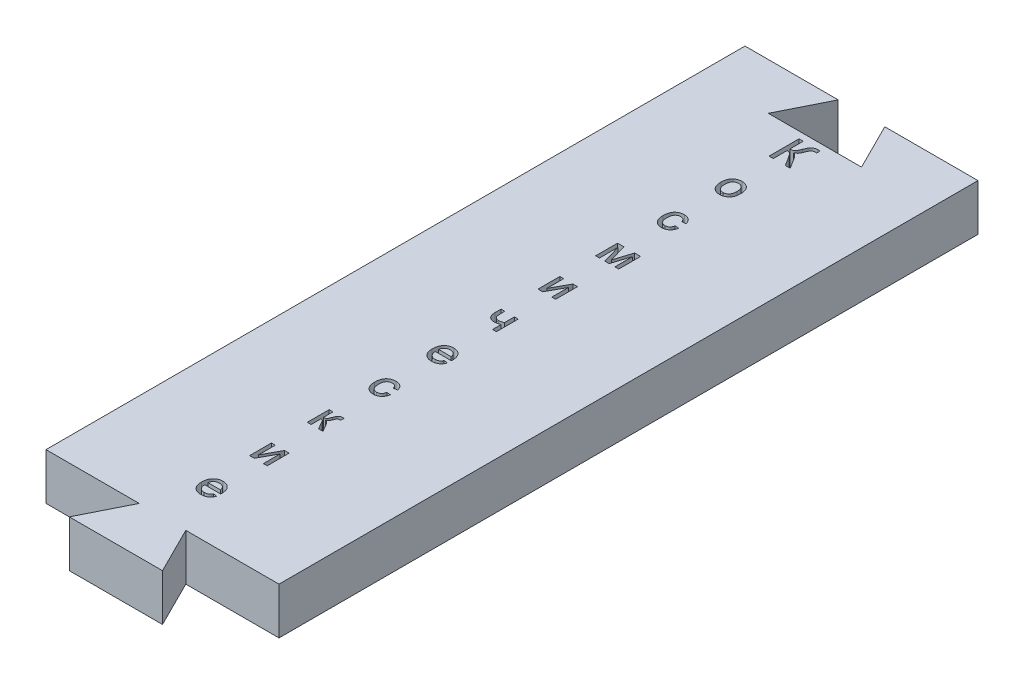
from build123d import *

# Parameters (mm, degrees)
EXTRUDE_1_DEPTH     = 4
CUT_EXTRUDE_1_DEPTH = 44.843471578


with BuildPart() as part:
    # Эскиз1 → Бобышка-Вытянуть1 (new body)
    with BuildSketch(Plane(origin=(0, 0, 0), x_dir=(1, 0, 0), z_dir=(0, 1, 0))):
        Polygon((10, 42.5), (2, 42.5), (4, 38.5), (-4, 38.5), (-2, 42.5), (-10, 42.5), (-10, -17.5), (-2, -17.5), (-4, -21.5), (4, -21.5), (2, -17.5), (10, -17.5), align=None)
    extrude(amount=EXTRUDE_1_DEPTH)

    # Эскиз2 → Вырез-Вытянуть1 (cut, through all)
    # profile 1 of 11: a face of its own
    with BuildSketch(Plane(origin=(0, 0, 0), x_dir=(1, 0, 0), z_dir=(0, 1, 0))):
        with BuildLine():
            Line((-0.784952159, 37.922443321), (-0.42275337, 37.922443321))
            Line((-0.42275337, 37.922443321), (-0.42275337, 36.769992629))
            add(Edge.make_bspline(
                [(-0.42275337, 36.769992629), (-0.403881568, 36.770314623), (-0.367463242, 36.770935998), (-0.314864045, 36.774948473), (-0.266491711, 36.781930258), (-0.222649993, 36.792260042), (-0.183058176, 36.804958938), (-0.148026012, 36.820875697), (-0.117099279, 36.839481866), (-0.08956018, 36.862044499), (-0.064195799, 36.890897859), (-0.038171899, 36.926434747), (-0.01091042, 36.970330579), (0.018184901, 37.021949927), (0.048591973, 37.082096414), (0.080139294, 37.150372427), (0.113733782, 37.226643308), (0.135765877, 37.280480457), (0.147298133, 37.30866043)],
                knots=[0, 0, 0, 0, 1.052200849, 2.030510562, 2.939243925, 3.774201544, 4.539213851, 5.253802474, 5.914681743, 6.546419206, 7.230145694, 8.050577361, 9.000291826, 10.109225702, 11.353633581, 12.756759924, 14.30239122, 16, 16, 16, 16], degree=3))
            add(Edge.make_bspline(
                [(0.147298133, 37.30866043), (0.155583277, 37.329631548), (0.171547327, 37.370039291), (0.196431945, 37.427449705), (0.219739551, 37.480274434), (0.241400604, 37.528610059), (0.26325839, 37.571549896), (0.283081777, 37.61013506), (0.302839692, 37.64328408), (0.326471473, 37.682200209), (0.360433187, 37.725261698), (0.407126331, 37.772485623), (0.462709382, 37.813877052), (0.523699256, 37.852010502), (0.59078251, 37.883307131), (0.662144029, 37.906035839), (0.736891187, 37.919739547), (0.787777454, 37.921534114), (0.81355869, 37.922443321)],
                knots=[0, 0, 0, 0, 1.107067364, 2.133128729, 3.071894941, 3.942310447, 4.733123171, 5.437484158, 6.071489014, 6.62756277, 7.671844125, 8.755510869, 9.878854834, 11.066000059, 12.282817432, 13.502486747, 14.734649208, 16, 16, 16, 16], degree=3))
            add(Edge.make_bspline(
                [(0.81355869, 37.922443321), (0.829336219, 37.922425752), (0.859004835, 37.922392714), (0.900508865, 37.922607217), (0.936008684, 37.921964656), (0.965500704, 37.921437164), (0.98901151, 37.921064346), (1.00664056, 37.920270399), (1.018405136, 37.920416281), (1.024160433, 37.919229772), (1.026041786, 37.918841913)],
                knots=[0, 0, 0, 0, 1.781031572, 3.349113717, 4.685027671, 5.788662687, 6.679388873, 7.337880823, 7.783559366, 8, 8, 8, 8], degree=3))
            Line((1.026041786, 37.918841913), (1.026041786, 37.622497449))
            add(Edge.make_bspline(
                [(1.026041786, 37.622497449), (1.022439824, 37.622467266), (1.013860769, 37.622395377), (0.998778191, 37.62317291), (0.97938632, 37.623437851), (0.964987656, 37.624159888), (0.957100539, 37.624555397)],
                knots=[0, 0, 0, 0, 0.626520386, 1.492229436, 2.626325481, 4, 4, 4, 4], degree=3))
            add(Edge.make_bspline(
                [(0.957100539, 37.624555397), (0.948525784, 37.624727971), (0.93326186, 37.625035172), (0.913022275, 37.625428904), (0.89845338, 37.626176686), (0.890560607, 37.626119853), (0.887644805, 37.626098857)],
                knots=[0, 0, 0, 0, 1.481338244, 2.636930747, 3.496445698, 4, 4, 4, 4], degree=3))
            add(Edge.make_bspline(
                [(0.887644805, 37.626098857), (0.861820437, 37.625229401), (0.813283249, 37.623595249), (0.745947273, 37.608569275), (0.68784555, 37.58460307), (0.657819889, 37.558842196), (0.64326352, 37.546353385)],
                knots=[0, 0, 0, 0, 1.174590339, 2.207655611, 3.131075699, 4, 4, 4, 4], degree=3))
            add(Edge.make_bspline(
                [(0.64326352, 37.546353385), (0.636270961, 37.538922122), (0.621140688, 37.522842594), (0.599753132, 37.494325113), (0.577762319, 37.460098966), (0.554606771, 37.420525898), (0.531025903, 37.375148419), (0.507026384, 37.324020841), (0.481674561, 37.267542214), (0.465463509, 37.227598495), (0.457019257, 37.206792021)],
                knots=[0, 0, 0, 0, 0.628540474, 1.360015561, 2.192637814, 3.135330014, 4.184910091, 5.343283619, 6.616130308, 8, 8, 8, 8], degree=3))
            add(Edge.make_bspline(
                [(0.457019257, 37.206792021), (0.446347071, 37.180497794), (0.42602825, 37.130436103), (0.394911836, 37.059692907), (0.365711658, 36.996254904), (0.337853891, 36.940224553), (0.310285829, 36.892231119), (0.28493428, 36.851318643), (0.260422517, 36.818159617), (0.229276935, 36.78430596), (0.188297737, 36.749980939), (0.135868777, 36.713905848), (0.079493823, 36.681140708), (0.039106599, 36.663613723), (0.018676404, 36.65474756)],
                knots=[0, 0, 0, 0, 1.397857698, 2.661387202, 3.806666014, 4.838102907, 5.742411196, 6.532257632, 7.208110389, 7.770151143, 8.794610225, 9.832771815, 10.903690579, 12, 12, 12, 12], degree=3))
            add(Edge.make_bspline(
                [(0.018676404, 36.65474756), (0.039143162, 36.647933075), (0.081332488, 36.633885978), (0.142374086, 36.600944598), (0.203084291, 36.558441024), (0.263573515, 36.506008414), (0.323207838, 36.4429746), (0.383218307, 36.37047634), (0.443001926, 36.287966838), (0.480355968, 36.228301425), (0.499721671, 36.197368692)],
                knots=[0, 0, 0, 0, 0.762095068, 1.57095118, 2.442900002, 3.380807643, 4.397950549, 5.50975311, 6.708964874, 8, 8, 8, 8], degree=3))
            Line((0.499721671, 36.197368692), (1.026041786, 35.354124636))
            Line((1.026041786, 35.354124636), (0.605191489, 35.354124636))
            Line((0.605191489, 35.354124636), (0.176623887, 36.040450182))
            add(Edge.make_bspline(
                [(0.176623887, 36.040450182), (0.16233128, 36.063502819), (0.134854165, 36.10782083), (0.093333897, 36.170710778), (0.054499649, 36.228477464), (0.01698633, 36.280521036), (-0.019026113, 36.326732743), (-0.052865759, 36.367681175), (-0.085238428, 36.402642716), (-0.116146134, 36.432728993), (-0.14698486, 36.458859929), (-0.180082799, 36.480409621), (-0.215343346, 36.498466288), (-0.25255593, 36.513376133), (-0.291902685, 36.525470668), (-0.333674607, 36.533333001), (-0.377504468, 36.538818777), (-0.407472242, 36.539271592), (-0.42275337, 36.539502491)],
                knots=[0, 0, 0, 0, 1.581856698, 3.041072597, 4.39487619, 5.641337078, 6.781756498, 7.811394101, 8.738576831, 9.559118158, 10.326224261, 11.091894446, 11.85684566, 12.633220501, 13.427430725, 14.25325867, 15.10930396, 16, 16, 16, 16], degree=3))
            Line((-0.42275337, 36.539502491), (-0.42275337, 35.354124636))
            Line((-0.42275337, 35.354124636), (-0.784952159, 35.354124636))
            Line((-0.784952159, 35.354124636), (-0.784952159, 37.922443321))
        make_face()
    # profile 2 of 11: a face of its own
    with BuildSketch(Plane(origin=(0, 0, 0), x_dir=(1, 0, 0), z_dir=(0, 1, 0))):
        with BuildLine():
            add(Edge.make_bspline(
                [(-0.916660809, 31.341289256), (-0.915738786, 31.382995008), (-0.913954605, 31.463698684), (-0.901178279, 31.580805932), (-0.8792742, 31.689527607), (-0.848534829, 31.789965821), (-0.808782729, 31.882152221), (-0.759674035, 31.965569583), (-0.702563154, 32.041750429), (-0.656985416, 32.084811237), (-0.634207492, 32.1063313)],
                knots=[0, 0, 0, 0, 1.189940866, 2.302622481, 3.356378305, 4.350088409, 5.294652018, 6.213657312, 7.107257627, 8, 8, 8, 8], degree=3))
            add(Edge.make_bspline(
                [(-0.634207492, 32.1063313), (-0.614285193, 32.122869666), (-0.574804106, 32.155644632), (-0.510363637, 32.197208401), (-0.443273937, 32.23291881), (-0.372942177, 32.262528193), (-0.299146081, 32.285150832), (-0.222115444, 32.300851953), (-0.141948724, 32.311109861), (-0.087340327, 32.312124002), (-0.059525607, 32.312640553)],
                knots=[0, 0, 0, 0, 0.994414631, 1.970684744, 2.940793954, 3.912782355, 4.898970837, 5.902128985, 6.931451948, 8, 8, 8, 8], degree=3))
            add(Edge.make_bspline(
                [(-0.059525607, 32.312640553), (-0.028800125, 32.311773682), (0.031319976, 32.310077488), (0.119542993, 32.299016452), (0.203084138, 32.27846112), (0.283019102, 32.251521262), (0.358137482, 32.215619373), (0.429625742, 32.172816961), (0.495733409, 32.120943886), (0.55772748, 32.062311196), (0.613653328, 31.99674054), (0.662378212, 31.924554099), (0.703641221, 31.84637545), (0.737726739, 31.762130476), (0.763866788, 31.671760286), (0.782087068, 31.575458004), (0.793759112, 31.473456892), (0.794944557, 31.403403757), (0.795551647, 31.367528089)],
                knots=[0, 0, 0, 0, 1.026363227, 2.008269884, 2.962742747, 3.895658536, 4.820662428, 5.738204837, 6.673158329, 7.621267452, 8.584296177, 9.545483285, 10.524327568, 11.531652541, 12.575780624, 13.660990097, 14.802144351, 16, 16, 16, 16], degree=3))
            add(Edge.make_bspline(
                [(0.795551647, 31.367528089), (0.795322906, 31.338364989), (0.794878493, 31.281704991), (0.789506556, 31.19914648), (0.781388742, 31.121376743), (0.770340212, 31.048307269), (0.755457309, 30.980055218), (0.736898127, 30.916675389), (0.715375011, 30.857825487), (0.690638093, 30.803442699), (0.662412249, 30.753087715), (0.63166232, 30.705675216), (0.597615314, 30.661277131), (0.560314876, 30.61996704), (0.520264349, 30.581445345), (0.477190468, 30.545566012), (0.431013722, 30.512845583), (0.365821363, 30.473118612), (0.279775563, 30.431489055), (0.170794248, 30.395813401), (0.057097815, 30.374069309), (-0.020329426, 30.371326471), (-0.059525607, 30.369937958)],
                knots=[0, 0, 0, 0, 1.174068422, 2.28105775, 3.329581501, 4.321819531, 5.255045276, 6.14001734, 6.978936381, 7.776151739, 8.542754425, 9.301196708, 10.049767304, 10.792968067, 11.540167917, 12.285482871, 13.048063169, 13.816653646, 15.357768987, 16.884132754, 18.422646949, 20, 20, 20, 20], degree=3))
            add(Edge.make_bspline(
                [(-0.059525607, 30.369937958), (-0.090770783, 30.37078537), (-0.151926348, 30.372443993), (-0.241397131, 30.383760547), (-0.326310365, 30.403151552), (-0.40640991, 30.431409616), (-0.482409661, 30.466097727), (-0.553591434, 30.509400459), (-0.620092773, 30.560374282), (-0.681326372, 30.619348046), (-0.737314363, 30.685007707), (-0.785107219, 30.758763095), (-0.826012061, 30.839092964), (-0.859431244, 30.926343758), (-0.884958838, 31.020518101), (-0.903290791, 31.121368073), (-0.914878362, 31.229032318), (-0.916055805, 31.303186621), (-0.916660809, 31.341289256)],
                knots=[0, 0, 0, 0, 1.022681766, 2.001674804, 2.94671416, 3.868132449, 4.777362857, 5.676573364, 6.589418535, 7.514523194, 8.454681358, 9.407574523, 10.384198733, 11.400667853, 12.460217505, 13.573389442, 14.753137007, 16, 16, 16, 16], degree=3))
        make_face()
        with BuildLine():
            add(Edge.make_bspline(
                [(-0.587389183, 31.34231823), (-0.586830386, 31.31486741), (-0.585749487, 31.261768422), (-0.579298614, 31.184697163), (-0.567514058, 31.113145803), (-0.551119031, 31.046854393), (-0.530090475, 30.985813533), (-0.50431763, 30.929919877), (-0.474081674, 30.879126044), (-0.438726513, 30.834260088), (-0.40024805, 30.794603564), (-0.358745824, 30.76039667), (-0.314797008, 30.731350754), (-0.268326908, 30.707667554), (-0.219545961, 30.688955698), (-0.168348036, 30.675482822), (-0.114642338, 30.667746661), (-0.078071649, 30.666775119), (-0.059525607, 30.666282422)],
                knots=[0, 0, 0, 0, 1.36128903, 2.633184439, 3.831299874, 4.953299848, 6.015607462, 7.027679361, 8.000438392, 8.93945591, 9.853536715, 10.73548639, 11.60109037, 12.460616037, 13.316600729, 14.187036799, 15.080594522, 16, 16, 16, 16], degree=3))
            add(Edge.make_bspline(
                [(-0.059525607, 30.666282422), (-0.041138936, 30.666702599), (-0.004860196, 30.667531651), (0.048146372, 30.676308878), (0.099160572, 30.68890069), (0.147760918, 30.707480642), (0.193543041, 30.731989285), (0.237394117, 30.760979758), (0.278425297, 30.795687124), (0.317343981, 30.835267664), (0.352193962, 30.880795628), (0.383453432, 30.931388298), (0.409136828, 30.988189754), (0.429900128, 31.050330185), (0.446476723, 31.117941893), (0.458206401, 31.191050699), (0.464619604, 31.26983221), (0.465715559, 31.324128577), (0.466280021, 31.352093481)],
                knots=[0, 0, 0, 0, 0.904535546, 1.784739026, 2.638791991, 3.488785886, 4.338695884, 5.191202824, 6.07237792, 6.980061329, 7.919174549, 8.889507933, 9.902165842, 10.981000531, 12.111539881, 13.326270405, 14.622917219, 16, 16, 16, 16], degree=3))
            add(Edge.make_bspline(
                [(0.466280021, 31.352093481), (0.465710801, 31.378514466), (0.464603759, 31.429898979), (0.458225093, 31.504589922), (0.44628907, 31.574214917), (0.430212906, 31.638970211), (0.408176469, 31.698322581), (0.382855834, 31.753397228), (0.351596301, 31.803101833), (0.316132723, 31.847716754), (0.277425715, 31.887421132), (0.236291101, 31.922265798), (0.192300387, 31.950881409), (0.146513366, 31.97520944), (0.098188485, 31.993387046), (0.047782424, 32.007137191), (-0.005093187, 32.01484769), (-0.04115163, 32.015807174), (-0.059525607, 32.01629609)],
                knots=[0, 0, 0, 0, 1.329905342, 2.586449315, 3.768451236, 4.882143757, 5.938857988, 6.950440627, 7.927559667, 8.885972819, 9.813736587, 10.714405609, 11.592966897, 12.450023853, 13.318821862, 14.185602452, 15.075453733, 16, 16, 16, 16], degree=3))
            add(Edge.make_bspline(
                [(-0.059525607, 32.01629609), (-0.078070074, 32.015799302), (-0.114637656, 32.014819693), (-0.168365958, 32.007142223), (-0.219422474, 31.993470072), (-0.268451993, 31.975574026), (-0.314750515, 31.951663183), (-0.358953853, 31.922776729), (-0.399885433, 31.887921793), (-0.438945982, 31.848878554), (-0.473895525, 31.80400753), (-0.504337274, 31.753724161), (-0.530193001, 31.698179793), (-0.551103986, 31.63726217), (-0.567518415, 31.570977759), (-0.579297623, 31.499424349), (-0.585734293, 31.422524642), (-0.586826334, 31.369597447), (-0.587389183, 31.34231823)],
                knots=[0, 0, 0, 0, 0.920966903, 1.816042154, 2.687956485, 3.542385364, 4.403370762, 5.270444796, 6.159337503, 7.068888003, 8.009500254, 8.976623456, 9.982690403, 11.046802133, 12.170707598, 13.370857791, 14.644913259, 16, 16, 16, 16], degree=3))
        make_face(mode=Mode.SUBTRACT)
    # profile 3 of 11: a face of its own
    with BuildSketch(Plane(origin=(0, 0, 0), x_dir=(1, 0, 0), z_dir=(0, 1, 0))):
        with BuildLine():
            Line((0.367498533, 26.143076021), (0.69677016, 26.110148858))
            add(Edge.make_bspline(
                [(0.69677016, 26.110148858), (0.692213318, 26.083822168), (0.683262652, 26.032110596), (0.662939847, 25.9573016), (0.637946914, 25.886883018), (0.607764759, 25.820810223), (0.573052191, 25.759193475), (0.53302839, 25.702024701), (0.488041163, 25.649339617), (0.438492077, 25.601185012), (0.384635987, 25.558520234), (0.328154393, 25.52057827), (0.268116088, 25.489319278), (0.205499182, 25.463316108), (0.139836351, 25.443295201), (0.071176874, 25.428762117), (-0.000509512, 25.420680257), (-0.049216854, 25.419352271), (-0.073931241, 25.418678443)],
                knots=[0, 0, 0, 0, 1.126290047, 2.212288299, 3.264625211, 4.274421374, 5.27199577, 6.243132084, 7.212758999, 8.189695438, 9.152066023, 10.106906036, 11.054818061, 12.001736236, 12.962610873, 13.945632539, 14.95760209, 16, 16, 16, 16], degree=3))
            add(Edge.make_bspline(
                [(-0.073931241, 25.418678443), (-0.104831048, 25.419539675), (-0.16546853, 25.421229747), (-0.254122751, 25.432392456), (-0.338040747, 25.452066286), (-0.417208829, 25.479404552), (-0.491948947, 25.514427668), (-0.561489554, 25.558103041), (-0.626994157, 25.608759332), (-0.687036936, 25.667448377), (-0.741289053, 25.733370394), (-0.788152744, 25.806605173), (-0.828614048, 25.886057459), (-0.860834504, 25.972638595), (-0.886021014, 26.065653728), (-0.903815764, 26.165497446), (-0.914721795, 26.271968897), (-0.916003421, 26.34524248), (-0.916660809, 26.382826924)],
                knots=[0, 0, 0, 0, 1.023197875, 2.007913629, 2.952854009, 3.872368111, 4.776711232, 5.679644676, 6.586124885, 7.513792122, 8.45395957, 9.406953999, 10.38727148, 11.400874437, 12.46026104, 13.574150989, 14.755701814, 16, 16, 16, 16], degree=3))
            add(Edge.make_bspline(
                [(-0.916660809, 26.382826924), (-0.916371876, 26.407529746), (-0.915801518, 26.456293556), (-0.911062203, 26.528225015), (-0.903458711, 26.597773483), (-0.892552387, 26.664892768), (-0.878970133, 26.729766947), (-0.861183804, 26.791954245), (-0.841199189, 26.851978424), (-0.818188259, 26.909446586), (-0.791976504, 26.964246269), (-0.762327834, 27.01559613), (-0.728996512, 27.063200888), (-0.693101161, 27.107762602), (-0.653300822, 27.148372288), (-0.610480343, 27.185566857), (-0.564531021, 27.219142305), (-0.499318988, 27.258664273), (-0.413103137, 27.29971941), (-0.304266754, 27.335541742), (-0.190719575, 27.357206886), (-0.113468279, 27.359980155), (-0.074445728, 27.361381038)],
                knots=[0, 0, 0, 0, 1.013805669, 2.001270362, 2.957354649, 3.884259307, 4.791280502, 5.67595866, 6.537369654, 7.386966453, 8.214944774, 9.028648359, 9.817495426, 10.598008034, 11.374511297, 12.14791384, 12.923651068, 13.707109795, 15.274991334, 16.830882343, 18.399158828, 20, 20, 20, 20], degree=3))
            add(Edge.make_bspline(
                [(-0.074445728, 27.361381038), (-0.049903763, 27.360866835), (-0.001741553, 27.35985774), (0.068588812, 27.352560979), (0.135728077, 27.340817221), (0.19923776, 27.323923541), (0.259579651, 27.302245789), (0.316194562, 27.275423542), (0.369461914, 27.243965745), (0.419046303, 27.207752072), (0.464901157, 27.167273595), (0.506035171, 27.122132555), (0.543616853, 27.073493514), (0.576208529, 27.020332957), (0.605548261, 26.963453866), (0.629208195, 26.90204423), (0.649811427, 26.837030991), (0.659103456, 26.791775412), (0.663842997, 26.768692111)],
                knots=[0, 0, 0, 0, 1.132709169, 2.22287732, 3.260172152, 4.27594812, 5.252565374, 6.215743486, 7.163376455, 8.103906971, 9.045968701, 9.981589193, 10.918916077, 11.878868217, 12.855998669, 13.868839979, 14.912969196, 16, 16, 16, 16], degree=3))
            Line((0.663842997, 26.768692111), (0.334571371, 26.735764948))
            add(Edge.make_bspline(
                [(0.334571371, 26.735764948), (0.326936033, 26.761766959), (0.31233294, 26.811497535), (0.27887838, 26.879311433), (0.23694054, 26.936662195), (0.186931366, 26.983657393), (0.130007134, 27.019908541), (0.067704939, 27.046507862), (-0.000609357, 27.062339672), (-0.047950348, 27.064118396), (-0.07238778, 27.065036574)],
                knots=[0, 0, 0, 0, 1.141726713, 2.183628378, 3.172002178, 4.124091198, 5.061356818, 6.004746239, 6.970049491, 8, 8, 8, 8], degree=3))
            add(Edge.make_bspline(
                [(-0.07238778, 27.065036574), (-0.091113724, 27.064587961), (-0.127702701, 27.063711408), (-0.181051694, 27.055520987), (-0.231970198, 27.043605924), (-0.279895844, 27.02517546), (-0.325575295, 27.002564531), (-0.368477118, 26.974689329), (-0.408305301, 26.941319843), (-0.445467666, 26.903268086), (-0.479281308, 26.859640347), (-0.508675556, 26.810138409), (-0.532620395, 26.754440366), (-0.552716038, 26.693318086), (-0.568625177, 26.626213055), (-0.579652784, 26.553083224), (-0.586427441, 26.474191628), (-0.587061615, 26.419712896), (-0.587389183, 26.391573201)],
                knots=[0, 0, 0, 0, 0.934506579, 1.825950114, 2.690068634, 3.541100821, 4.383731181, 5.231784627, 6.089299408, 6.973555431, 7.883203127, 8.839396139, 9.840301414, 10.904673265, 12.049269491, 13.27993044, 14.595012659, 16, 16, 16, 16], degree=3))
            add(Edge.make_bspline(
                [(-0.587389183, 26.391573201), (-0.587085414, 26.362916472), (-0.586500607, 26.307747393), (-0.579493237, 26.228057128), (-0.569155258, 26.154206367), (-0.553575898, 26.086544832), (-0.534964333, 26.024385169), (-0.510630483, 25.968799642), (-0.482428812, 25.918914863), (-0.449711681, 25.875362793), (-0.413465562, 25.837502128), (-0.374093299, 25.805234019), (-0.332758271, 25.776838231), (-0.288238207, 25.754275839), (-0.241135503, 25.736597916), (-0.191366292, 25.724493398), (-0.139192356, 25.716384664), (-0.103460135, 25.715482616), (-0.085249953, 25.715022907)],
                knots=[0, 0, 0, 0, 1.439417322, 2.771123253, 4.016540659, 5.182963063, 6.256782941, 7.271700823, 8.22505475, 9.129818122, 10.001307906, 10.851929949, 11.68361798, 12.516019905, 13.353091662, 14.205762507, 15.085604268, 16, 16, 16, 16], degree=3))
            add(Edge.make_bspline(
                [(-0.085249953, 25.715022907), (-0.070655296, 25.715261217), (-0.041885603, 25.715730986), (0.000412765, 25.721193922), (0.040885998, 25.729205148), (0.079537563, 25.740576218), (0.116109828, 25.755678926), (0.151122214, 25.773620574), (0.184393974, 25.794750205), (0.215130752, 25.819718593), (0.244467483, 25.847310312), (0.269866714, 25.879613126), (0.293316411, 25.914774913), (0.313806317, 25.953618805), (0.331969488, 25.99586426), (0.346509351, 26.041809809), (0.359305453, 26.091017516), (0.364709025, 26.125351597), (0.367498533, 26.143076021)],
                knots=[0, 0, 0, 0, 1.014969467, 2.000756802, 2.962635172, 3.883905016, 4.799126561, 5.711777145, 6.618793064, 7.535724579, 8.464077664, 9.414562763, 10.387627853, 11.401965749, 12.465912699, 13.582944017, 14.752233276, 16, 16, 16, 16], degree=3))
        make_face()
    # profile 4 of 11: a face of its own
    with BuildSketch(Plane(origin=(0, 0, 0), x_dir=(1, 0, 0), z_dir=(0, 1, 0))):
        Polygon((-0.817879321, 22.37719436), (-0.27921152, 22.37719436), (0.164790688, 20.874892565), (0.645835955, 22.37719436), (1.157750436, 22.37719436), (1.157750436, 20.500346091), (0.82847881, 20.500346091), (0.82847881, 22.011394163), (0.344861109, 20.500346091), (-0.025569471, 20.500346091), (-0.488607695, 22.083936818), (-0.488607695, 20.500346091), (-0.817879321, 20.500346091), align=None)
    # profile 5 of 11: a face of its own
    with BuildSketch(Plane(origin=(0, 0, 0), x_dir=(1, 0, 0), z_dir=(0, 1, 0))):
        Polygon((-0.817879321, 17.425934845), (-0.488607695, 17.425934845), (-0.488607695, 15.994632245), (0.29958626, 17.425934845), (0.69677016, 17.425934845), (0.69677016, 15.549086575), (0.367498533, 15.549086575), (0.367498533, 16.971642898), (-0.415550553, 15.549086575), (-0.817879321, 15.549086575), align=None)
    # profile 6 of 11: a face of its own
    with BuildSketch(Plane(origin=(0, 0, 0), x_dir=(1, 0, 0), z_dir=(0, 1, 0))):
        with BuildLine():
            Line((-0.916660809, 12.47467533), (-0.587389183, 12.47467533))
            Line((-0.587389183, 12.47467533), (-0.587389183, 12.116077949))
            add(Edge.make_bspline(
                [(-0.587389183, 12.116077949), (-0.587242842, 12.097385037), (-0.586960879, 12.061368503), (-0.586149635, 12.009387091), (-0.583892735, 11.961374964), (-0.58155731, 11.917266316), (-0.578014708, 11.87710417), (-0.573363635, 11.841087797), (-0.56813918, 11.809022429), (-0.561225962, 11.771438698), (-0.545913967, 11.72833891), (-0.519461035, 11.680405877), (-0.483567328, 11.636315186), (-0.440284073, 11.595793069), (-0.388993584, 11.561539904), (-0.330213486, 11.537487334), (-0.265612972, 11.521886239), (-0.220312759, 11.520502813), (-0.196893614, 11.519787614)],
                knots=[0, 0, 0, 0, 1.092932171, 2.105805044, 3.039129658, 3.902862933, 4.688071299, 5.395702065, 6.0253777, 6.587755016, 7.627805861, 8.682494201, 9.773907611, 10.937411235, 12.138749086, 13.356584522, 14.633416332, 16, 16, 16, 16], degree=3))
            add(Edge.make_bspline(
                [(-0.196893614, 11.519787614), (-0.182474738, 11.5200932), (-0.152539908, 11.520727625), (-0.106060285, 11.525936564), (-0.056315162, 11.532670721), (-0.003783936, 11.544064107), (0.051896444, 11.557239415), (0.110542367, 11.573882411), (0.172328125, 11.593390075), (0.214227279, 11.608315553), (0.235789883, 11.615996667)],
                knots=[0, 0, 0, 0, 0.77694901, 1.613013217, 2.518923353, 3.481535224, 4.508354503, 5.602841085, 6.766347686, 8, 8, 8, 8], degree=3))
            Line((0.235789883, 11.615996667), (0.235789883, 12.47467533))
            Line((0.235789883, 12.47467533), (0.565061509, 12.47467533))
            Line((0.565061509, 12.47467533), (0.565061509, 10.59782706))
            Line((0.565061509, 10.59782706), (0.235789883, 10.59782706))
            Line((0.235789883, 10.59782706), (0.235789883, 11.325311559))
            add(Edge.make_bspline(
                [(0.235789883, 11.325311559), (0.190078755, 11.309526861), (0.101200455, 11.278835927), (-0.032840312, 11.248310573), (-0.161735089, 11.226910453), (-0.246545619, 11.224580731), (-0.287957798, 11.22344315)],
                knots=[0, 0, 0, 0, 1.081616507, 2.103037932, 3.073731385, 4, 4, 4, 4], degree=3))
            add(Edge.make_bspline(
                [(-0.287957798, 11.22344315), (-0.304785022, 11.223632728), (-0.338025648, 11.224007221), (-0.38696462, 11.230203567), (-0.434527074, 11.238587475), (-0.480457154, 11.251365206), (-0.525376144, 11.266234645), (-0.568143397, 11.286469927), (-0.609954266, 11.308677457), (-0.661984966, 11.343603711), (-0.72097961, 11.392126131), (-0.781232002, 11.458048972), (-0.828515528, 11.530771227), (-0.863275725, 11.609716962), (-0.886454081, 11.693734269), (-0.904202462, 11.781216857), (-0.914558907, 11.872993169), (-0.915949985, 11.935467543), (-0.916660809, 11.967391231)],
                knots=[0, 0, 0, 0, 0.73391781, 1.449786807, 2.150106631, 2.840109291, 3.528974137, 4.212285506, 4.902288166, 5.593629417, 6.944042901, 8.226525853, 9.476416819, 10.712989717, 11.975636823, 13.27336444, 14.606720527, 16, 16, 16, 16], degree=3))
            Line((-0.916660809, 11.967391231), (-0.916660809, 12.47467533))
        make_face()
    # profile 7 of 11: a face of its own
    with BuildSketch(Plane(origin=(0, 0, 0), x_dir=(1, 0, 0), z_dir=(0, 1, 0))):
        with BuildLine():
            Line((0.462678613, 6.206329309), (0.785261909, 6.173402147))
            add(Edge.make_bspline(
                [(0.785261909, 6.173402147), (0.778647673, 6.15164308), (0.765636177, 6.108838738), (0.739235783, 6.048129238), (0.710225315, 5.990452331), (0.675950037, 5.937064864), (0.638341729, 5.886830588), (0.596655238, 5.840150193), (0.549979348, 5.798201495), (0.500049017, 5.759232679), (0.44603346, 5.724985656), (0.388502075, 5.694749616), (0.327244205, 5.669795857), (0.262434679, 5.649007979), (0.193925355, 5.633153161), (0.121843338, 5.622199929), (0.046283729, 5.614439983), (-0.005312101, 5.613911242), (-0.031743314, 5.613640382)],
                knots=[0, 0, 0, 0, 1.017198368, 2.001028156, 2.958938375, 3.904526299, 4.836491671, 5.766019286, 6.700699831, 7.641977538, 8.598163567, 9.559604839, 10.547559217, 11.555094156, 12.60347703, 13.691418688, 14.817373327, 16, 16, 16, 16], degree=3))
            add(Edge.make_bspline(
                [(-0.031743314, 5.613640382), (-0.064880233, 5.614419085), (-0.12948695, 5.615937313), (-0.22383719, 5.628116932), (-0.312958761, 5.647383732), (-0.397045751, 5.674681404), (-0.475559295, 5.71025527), (-0.548698773, 5.754007309), (-0.61691912, 5.804926701), (-0.67923831, 5.863910178), (-0.735622222, 5.929648156), (-0.783776387, 6.002743027), (-0.825539672, 6.081443024), (-0.858755544, 6.16702654), (-0.885009573, 6.258636683), (-0.903225714, 6.356663323), (-0.914880398, 6.460717541), (-0.916057075, 6.532309772), (-0.916660809, 6.569042585)],
                knots=[0, 0, 0, 0, 1.077616366, 2.10101772, 3.089143248, 4.040031729, 4.971276009, 5.886882173, 6.807369977, 7.734796568, 8.672701003, 9.618074947, 10.576315496, 11.565652878, 12.598619221, 13.67195277, 14.805516698, 16, 16, 16, 16], degree=3))
            add(Edge.make_bspline(
                [(-0.916660809, 6.569042585), (-0.916051224, 6.607143687), (-0.914867596, 6.681124413), (-0.903362341, 6.788840208), (-0.884335025, 6.889974839), (-0.858515506, 6.984895231), (-0.824302935, 7.073142844), (-0.782557396, 7.154685507), (-0.733537012, 7.229964716), (-0.676768265, 7.297878141), (-0.613953261, 7.358269742), (-0.547087786, 7.411971192), (-0.474768518, 7.456289215), (-0.39847371, 7.493085092), (-0.31746803, 7.521355382), (-0.23225048, 7.542175059), (-0.142172195, 7.553923033), (-0.080652644, 7.555524924), (-0.049235869, 7.556342977)],
                knots=[0, 0, 0, 0, 1.232307979, 2.392766439, 3.499416159, 4.558769794, 5.570548426, 6.555643267, 7.517416609, 8.470735273, 9.412423306, 10.33263532, 11.239503873, 12.150233765, 13.067967044, 14.009932887, 14.983713455, 16, 16, 16, 16], degree=3))
            add(Edge.make_bspline(
                [(-0.049235869, 7.556342977), (-0.018838944, 7.555561316), (0.040648723, 7.554031581), (0.127800166, 7.541753779), (0.210844953, 7.522567643), (0.289608733, 7.494700829), (0.363695093, 7.458120993), (0.43390417, 7.414462116), (0.499745508, 7.362460633), (0.560796836, 7.302825105), (0.616423684, 7.236225099), (0.664541741, 7.162402329), (0.705285766, 7.082394856), (0.738314896, 6.995591013), (0.763739507, 6.902491123), (0.782158961, 6.803034234), (0.793775141, 6.69725416), (0.794948477, 6.624466972), (0.795551647, 6.587049627)],
                knots=[0, 0, 0, 0, 1.005323219, 1.967446859, 2.906060863, 3.821317632, 4.724696067, 5.63467896, 6.55185077, 7.494776645, 8.453732942, 9.416859909, 10.403972786, 11.418730779, 12.484189468, 13.592581733, 14.76243057, 16, 16, 16, 16], degree=3))
            add(Edge.make_bspline(
                [(0.795551647, 6.587049627), (0.79539496, 6.575387661), (0.795017041, 6.547259949), (0.794380697, 6.51913683), (0.794008187, 6.502673773)],
                knots=[0, 0, 0, 0, 0.829215456, 2, 2, 2, 2], degree=3))
            Line((0.794008187, 6.502673773), (-0.587389183, 6.502673773))
            add(Edge.make_bspline(
                [(-0.587389183, 6.502673773), (-0.585482952, 6.479484562), (-0.581753601, 6.434117197), (-0.57087827, 6.36843362), (-0.556201748, 6.306704525), (-0.53644542, 6.249473442), (-0.513106617, 6.1960994), (-0.484263786, 6.147460321), (-0.452130419, 6.102475923), (-0.415209981, 6.062242952), (-0.375365666, 6.026456055), (-0.332727471, 5.995062884), (-0.287371008, 5.969024732), (-0.239952433, 5.947135025), (-0.19002863, 5.930662994), (-0.137827433, 5.918875121), (-0.083057503, 5.911500261), (-0.04565782, 5.910496418), (-0.026598444, 5.909984846)],
                knots=[0, 0, 0, 0, 1.224729154, 2.396059788, 3.502114335, 4.561587772, 5.580251543, 6.563724943, 7.533714888, 8.486186356, 9.43260269, 10.350144711, 11.268619442, 12.181885516, 13.095687177, 14.031096784, 14.996620783, 16, 16, 16, 16], degree=3))
            add(Edge.make_bspline(
                [(-0.026598444, 5.909984846), (0.001229596, 5.910916574), (0.055139542, 5.912721567), (0.13292671, 5.925384891), (0.204230877, 5.947712872), (0.269553137, 5.978707033), (0.328785091, 6.019792309), (0.380469944, 6.072380704), (0.426421608, 6.13470739), (0.450321709, 6.181919539), (0.462678613, 6.206329309)],
                knots=[0, 0, 0, 0, 1.096312125, 2.123833578, 3.094060441, 4.030938787, 4.962563683, 5.918139224, 6.923629937, 8, 8, 8, 8], degree=3))
        make_face()
        with BuildLine():
            Line((-0.587389183, 6.799018237), (0.466280021, 6.799018237))
            add(Edge.make_bspline(
                [(0.466280021, 6.799018237), (0.464207341, 6.815332517), (0.460154799, 6.847230503), (0.451624849, 6.893366954), (0.440248609, 6.936351929), (0.42654767, 6.976023975), (0.409840306, 7.012459042), (0.390963706, 7.045713035), (0.369871476, 7.076141084), (0.353478566, 7.093824602), (0.345375596, 7.102565517)],
                knots=[0, 0, 0, 0, 1.185316253, 2.317552585, 3.379013743, 4.387694847, 5.339152611, 6.263729899, 7.141766409, 8, 8, 8, 8], degree=3))
            add(Edge.make_bspline(
                [(0.345375596, 7.102565517), (0.332428896, 7.115201908), (0.306856952, 7.14016094), (0.264221598, 7.172334729), (0.218401185, 7.199016065), (0.170286516, 7.222037152), (0.118801395, 7.238715327), (0.064976629, 7.25131472), (0.008062964, 7.258452059), (-0.030866799, 7.259475186), (-0.050779329, 7.259998514)],
                knots=[0, 0, 0, 0, 0.989486767, 1.954405495, 2.91383024, 3.888017634, 4.867526279, 5.869356945, 6.910178459, 8, 8, 8, 8], degree=3))
            add(Edge.make_bspline(
                [(-0.050779329, 7.259998514), (-0.068801607, 7.259579998), (-0.104078972, 7.258760783), (-0.156050295, 7.252995971), (-0.205861496, 7.243439392), (-0.253424276, 7.229260175), (-0.298912369, 7.212027017), (-0.342005932, 7.189997721), (-0.383006614, 7.164400445), (-0.421751109, 7.135120641), (-0.456800609, 7.102307228), (-0.488853834, 7.067353642), (-0.515390693, 7.028721913), (-0.538919626, 6.988212027), (-0.557342939, 6.944559725), (-0.571846584, 6.89840806), (-0.582170915, 6.849629839), (-0.585634261, 6.816039092), (-0.587389183, 6.799018237)],
                knots=[0, 0, 0, 0, 1.10270868, 2.158476208, 3.195774995, 4.201977093, 5.192014471, 6.168217026, 7.158254405, 8.146844603, 9.134487423, 10.093158795, 11.042305272, 11.996428104, 12.955501471, 13.934632866, 14.95345241, 16, 16, 16, 16], degree=3))
        make_face(mode=Mode.SUBTRACT)
    # profile 8 of 11: a face of its own
    with BuildSketch(Plane(origin=(0, 0, 0), x_dir=(1, 0, 0), z_dir=(0, 1, 0))):
        with BuildLine():
            Line((0.367498533, 1.386778445), (0.69677016, 1.353851282))
            add(Edge.make_bspline(
                [(0.69677016, 1.353851282), (0.692213318, 1.327524592), (0.683262652, 1.27581302), (0.662939847, 1.201004024), (0.637946914, 1.130585442), (0.607764759, 1.064512647), (0.573052191, 1.002895899), (0.53302839, 0.945727125), (0.488041163, 0.893042041), (0.438492077, 0.844887436), (0.384635987, 0.802222658), (0.328154393, 0.764280694), (0.268116088, 0.733021701), (0.205499182, 0.707018531), (0.139836351, 0.686997625), (0.071176874, 0.67246454), (-0.000509512, 0.66438268), (-0.049216854, 0.663054695), (-0.073931241, 0.662380867)],
                knots=[0, 0, 0, 0, 1.126290047, 2.212288299, 3.264625211, 4.274421374, 5.27199577, 6.243132084, 7.212758999, 8.189695438, 9.152066023, 10.106906036, 11.054818061, 12.001736236, 12.962610873, 13.945632539, 14.95760209, 16, 16, 16, 16], degree=3))
            add(Edge.make_bspline(
                [(-0.073931241, 0.662380867), (-0.104831048, 0.663242099), (-0.16546853, 0.664932171), (-0.254122751, 0.67609488), (-0.338040747, 0.695768709), (-0.417208829, 0.723106976), (-0.491948947, 0.758130092), (-0.561489554, 0.801805465), (-0.626994157, 0.852461756), (-0.687036936, 0.911150801), (-0.741289053, 0.977072818), (-0.788152744, 1.050307597), (-0.828614048, 1.129759883), (-0.860834504, 1.216341019), (-0.886021014, 1.309356152), (-0.903815764, 1.40919987), (-0.914721795, 1.515671321), (-0.916003421, 1.588944904), (-0.916660809, 1.626529348)],
                knots=[0, 0, 0, 0, 1.023197875, 2.007913629, 2.952854009, 3.872368111, 4.776711232, 5.679644676, 6.586124885, 7.513792122, 8.45395957, 9.406953999, 10.38727148, 11.400874437, 12.46026104, 13.574150989, 14.755701814, 16, 16, 16, 16], degree=3))
            add(Edge.make_bspline(
                [(-0.916660809, 1.626529348), (-0.916371876, 1.65123217), (-0.915801518, 1.69999598), (-0.911062203, 1.771927439), (-0.903458711, 1.841475907), (-0.892552387, 1.908595192), (-0.878970133, 1.973469371), (-0.861183804, 2.035656669), (-0.841199189, 2.095680848), (-0.818188259, 2.15314901), (-0.791976504, 2.207948693), (-0.762327834, 2.259298554), (-0.728996512, 2.306903311), (-0.693101161, 2.351465026), (-0.653300822, 2.392074712), (-0.610480343, 2.429269281), (-0.564531021, 2.462844729), (-0.499318988, 2.502366696), (-0.413103137, 2.543421834), (-0.304266754, 2.579244166), (-0.190719575, 2.60090931), (-0.113468279, 2.603682579), (-0.074445728, 2.605083462)],
                knots=[0, 0, 0, 0, 1.013805669, 2.001270362, 2.957354649, 3.884259307, 4.791280502, 5.67595866, 6.537369654, 7.386966453, 8.214944774, 9.028648359, 9.817495426, 10.598008034, 11.374511297, 12.14791384, 12.923651068, 13.707109795, 15.274991334, 16.830882343, 18.399158828, 20, 20, 20, 20], degree=3))
            add(Edge.make_bspline(
                [(-0.074445728, 2.605083462), (-0.049903763, 2.604569259), (-0.001741553, 2.603560164), (0.068588812, 2.596263403), (0.135728077, 2.584519645), (0.19923776, 2.567625965), (0.259579651, 2.545948213), (0.316194562, 2.519125966), (0.369461914, 2.487668169), (0.419046303, 2.451454496), (0.464901157, 2.410976019), (0.506035171, 2.365834979), (0.543616853, 2.317195938), (0.576208529, 2.264035381), (0.605548261, 2.20715629), (0.629208195, 2.145746653), (0.649811427, 2.080733415), (0.659103456, 2.035477836), (0.663842997, 2.012394535)],
                knots=[0, 0, 0, 0, 1.132709169, 2.22287732, 3.260172152, 4.27594812, 5.252565374, 6.215743486, 7.163376455, 8.103906971, 9.045968701, 9.981589193, 10.918916077, 11.878868217, 12.855998669, 13.868839979, 14.912969196, 16, 16, 16, 16], degree=3))
            Line((0.663842997, 2.012394535), (0.334571371, 1.979467372))
            add(Edge.make_bspline(
                [(0.334571371, 1.979467372), (0.326936033, 2.005469382), (0.31233294, 2.055199959), (0.27887838, 2.123013857), (0.23694054, 2.180364618), (0.186931366, 2.227359817), (0.130007134, 2.263610965), (0.067704939, 2.290210286), (-0.000609357, 2.306042096), (-0.047950348, 2.30782082), (-0.07238778, 2.308738998)],
                knots=[0, 0, 0, 0, 1.141726713, 2.183628378, 3.172002178, 4.124091198, 5.061356818, 6.004746239, 6.970049491, 8, 8, 8, 8], degree=3))
            add(Edge.make_bspline(
                [(-0.07238778, 2.308738998), (-0.091113724, 2.308290385), (-0.127702701, 2.307413832), (-0.181051694, 2.299223411), (-0.231970198, 2.287308348), (-0.279895844, 2.268877884), (-0.325575295, 2.246266955), (-0.368477118, 2.218391753), (-0.408305301, 2.185022267), (-0.445467666, 2.14697051), (-0.479281308, 2.103342771), (-0.508675556, 2.053840833), (-0.532620395, 1.998142789), (-0.552716038, 1.93702051), (-0.568625177, 1.869915479), (-0.579652784, 1.796785647), (-0.586427441, 1.717894052), (-0.587061615, 1.66341532), (-0.587389183, 1.635275625)],
                knots=[0, 0, 0, 0, 0.934506579, 1.825950114, 2.690068634, 3.541100821, 4.383731181, 5.231784627, 6.089299408, 6.973555431, 7.883203127, 8.839396139, 9.840301414, 10.904673265, 12.049269491, 13.27993044, 14.595012659, 16, 16, 16, 16], degree=3))
            add(Edge.make_bspline(
                [(-0.587389183, 1.635275625), (-0.587085414, 1.606618896), (-0.586500607, 1.551449817), (-0.579493237, 1.471759551), (-0.569155258, 1.39790879), (-0.553575898, 1.330247256), (-0.534964333, 1.268087593), (-0.510630483, 1.212502066), (-0.482428812, 1.162617287), (-0.449711681, 1.119065217), (-0.413465562, 1.081204552), (-0.374093299, 1.048936443), (-0.332758271, 1.020540655), (-0.288238207, 0.997978263), (-0.241135503, 0.98030034), (-0.191366292, 0.968195821), (-0.139192356, 0.960087088), (-0.103460135, 0.95918504), (-0.085249953, 0.958725331)],
                knots=[0, 0, 0, 0, 1.439417322, 2.771123253, 4.016540659, 5.182963063, 6.256782941, 7.271700823, 8.22505475, 9.129818122, 10.001307906, 10.851929949, 11.68361798, 12.516019905, 13.353091662, 14.205762507, 15.085604268, 16, 16, 16, 16], degree=3))
            add(Edge.make_bspline(
                [(-0.085249953, 0.958725331), (-0.070655296, 0.958963641), (-0.041885603, 0.95943341), (0.000412765, 0.964896346), (0.040885998, 0.972907572), (0.079537563, 0.984278642), (0.116109828, 0.99938135), (0.151122214, 1.017322998), (0.184393974, 1.038452629), (0.215130752, 1.063421017), (0.244467483, 1.091012736), (0.269866714, 1.12331555), (0.293316411, 1.158477337), (0.313806317, 1.197321229), (0.331969488, 1.239566684), (0.346509351, 1.285512232), (0.359305453, 1.33471994), (0.364709025, 1.369054021), (0.367498533, 1.386778445)],
                knots=[0, 0, 0, 0, 1.014969467, 2.000756802, 2.962635172, 3.883905016, 4.799126561, 5.711777145, 6.618793064, 7.535724579, 8.464077664, 9.414562763, 10.387627853, 11.401965749, 12.465912699, 13.582944017, 14.752233276, 16, 16, 16, 16], degree=3))
        make_face()
    # profile 9 of 11: a face of its own
    with BuildSketch(Plane(origin=(0, 0, 0), x_dir=(1, 0, 0), z_dir=(0, 1, 0))):
        with BuildLine():
            Line((-0.817879321, -2.379103216), (-0.488607695, -2.379103216))
            Line((-0.488607695, -2.379103216), (-0.488607695, -3.202282282))
            add(Edge.make_bspline(
                [(-0.488607695, -3.202282282), (-0.465234539, -3.201754358), (-0.421934064, -3.20077634), (-0.362548006, -3.189808279), (-0.31420074, -3.171484534), (-0.280795748, -3.148816893), (-0.259594504, -3.123174449), (-0.242147995, -3.097552538), (-0.222673625, -3.065118218), (-0.201723867, -3.025372651), (-0.179297331, -2.978597138), (-0.155031068, -2.924938039), (-0.129451616, -2.864081082), (-0.11195701, -2.821066212), (-0.102742508, -2.798410052)],
                knots=[0, 0, 0, 0, 1.373121036, 2.543806828, 3.530563667, 4.397947377, 4.876975687, 5.47833956, 6.22018668, 7.099791762, 8.118986325, 9.269745027, 10.5619603, 12, 12, 12, 12], degree=3))
            add(Edge.make_bspline(
                [(-0.102742508, -2.798410052), (-0.095649579, -2.780357376), (-0.082009371, -2.745640794), (-0.060725897, -2.696640476), (-0.041448936, -2.651932095), (-0.022149528, -2.612592089), (-0.005020705, -2.57749204), (0.011594749, -2.547529871), (0.026734992, -2.522254199), (0.045847748, -2.495564846), (0.070488063, -2.46831705), (0.101352373, -2.440197314), (0.135304864, -2.419064124), (0.172604733, -2.402574323), (0.216877894, -2.392259839), (0.269978953, -2.384024825), (0.333996144, -2.379892077), (0.380185934, -2.379379308), (0.405056078, -2.379103216)],
                knots=[0, 0, 0, 0, 1.273565336, 2.449156767, 3.507993669, 4.470059667, 5.326243169, 6.072238734, 6.719270643, 7.259948272, 8.225107209, 9.126674344, 9.992139639, 10.839463651, 11.792722913, 12.96658696, 14.366707864, 16, 16, 16, 16], degree=3))
            Line((0.405056078, -2.379103216), (0.466280021, -2.379103216))
            Line((0.466280021, -2.379103216), (0.466280021, -2.677505627))
            Line((0.466280021, -2.677505627), (0.380875193, -2.67544768))
            add(Edge.make_bspline(
                [(0.380875193, -2.67544768), (0.362304167, -2.675678317), (0.32878735, -2.676094569), (0.284132603, -2.682672236), (0.248840543, -2.692479004), (0.232269723, -2.705665397), (0.224985658, -2.711461764)],
                knots=[0, 0, 0, 0, 1.361575694, 2.457359391, 3.321898639, 4, 4, 4, 4], degree=3))
            add(Edge.make_bspline(
                [(0.224985658, -2.711461764), (0.221636403, -2.715337296), (0.213990082, -2.724185104), (0.203466733, -2.740960051), (0.191792954, -2.761986715), (0.178683723, -2.787701702), (0.164653538, -2.818163838), (0.149087155, -2.853271843), (0.132767112, -2.893024924), (0.121392624, -2.92102575), (0.115399944, -2.935778059)],
                knots=[0, 0, 0, 0, 0.490171009, 1.119056291, 1.891467833, 2.795298515, 3.883195796, 5.104375149, 6.474432455, 8, 8, 8, 8], degree=3))
            add(Edge.make_bspline(
                [(0.115399944, -2.935778059), (0.104164481, -2.963324118), (0.083455246, -3.014097087), (0.051135336, -3.08299933), (0.019805924, -3.137841099), (-0.011312594, -3.181623909), (-0.046726187, -3.216654921), (-0.088491325, -3.247693184), (-0.137298853, -3.278332659), (-0.173708288, -3.295614053), (-0.192777718, -3.304665178)],
                knots=[0, 0, 0, 0, 1.434573394, 2.644209498, 3.666949491, 4.477476665, 5.22601469, 6.058028638, 6.982893133, 8, 8, 8, 8], degree=3))
            add(Edge.make_bspline(
                [(-0.192777718, -3.304665178), (-0.176092911, -3.30996342), (-0.141743452, -3.320871052), (-0.092721463, -3.348353414), (-0.043473532, -3.383037861), (0.005261746, -3.426603818), (0.053597619, -3.478541241), (0.102096339, -3.538397909), (0.149786333, -3.607100524), (0.179971175, -3.656580894), (0.195659903, -3.682298574)],
                knots=[0, 0, 0, 0, 0.756347684, 1.557113244, 2.420453883, 3.362228007, 4.381487037, 5.490316468, 6.695578911, 8, 8, 8, 8], degree=3))
            Line((0.195659903, -3.682298574), (0.532134346, -4.255951486))
            Line((0.532134346, -4.255951486), (0.156044411, -4.255951486))
            Line((0.156044411, -4.255951486), (-0.168082346, -3.702363564))
            add(Edge.make_bspline(
                [(-0.168082346, -3.702363564), (-0.175549976, -3.687573616), (-0.189865783, -3.659220573), (-0.211722395, -3.61904702), (-0.231906259, -3.582235652), (-0.252577564, -3.550038506), (-0.272222571, -3.521613897), (-0.290525419, -3.496741574), (-0.308473131, -3.475956942), (-0.331656708, -3.454234952), (-0.361571839, -3.432299999), (-0.400947396, -3.413476038), (-0.44368211, -3.401662292), (-0.47343902, -3.400458761), (-0.488607695, -3.399845257)],
                knots=[0, 0, 0, 0, 1.27446017, 2.443201492, 3.518318278, 4.502845006, 5.38479524, 6.176366746, 6.87757679, 7.493557552, 8.617740829, 9.715288334, 10.835361238, 12, 12, 12, 12], degree=3))
            Line((-0.488607695, -3.399845257), (-0.488607695, -4.255951486))
            Line((-0.488607695, -4.255951486), (-0.817879321, -4.255951486))
            Line((-0.817879321, -4.255951486), (-0.817879321, -2.379103216))
        make_face()
    # profile 10 of 11: a face of its own
    with BuildSketch(Plane(origin=(0, 0, 0), x_dir=(1, 0, 0), z_dir=(0, 1, 0))):
        Polygon((-0.817879321, -7.330362731), (-0.488607695, -7.330362731), (-0.488607695, -8.761665332), (0.29958626, -7.330362731), (0.69677016, -7.330362731), (0.69677016, -9.207211001), (0.367498533, -9.207211001), (0.367498533, -7.784654678), (-0.415550553, -9.207211001), (-0.817879321, -9.207211001), align=None)
    # profile 11 of 11: a face of its own
    with BuildSketch(Plane(origin=(0, 0, 0), x_dir=(1, 0, 0), z_dir=(0, 1, 0))):
        with BuildLine():
            Line((0.462678613, -13.598708751), (0.785261909, -13.631635914))
            add(Edge.make_bspline(
                [(0.785261909, -13.631635914), (0.778647673, -13.653394981), (0.765636177, -13.696199322), (0.739235783, -13.756908823), (0.710225315, -13.81458573), (0.675950037, -13.867973197), (0.638341729, -13.918207473), (0.596655238, -13.964887868), (0.549979348, -14.006836566), (0.500049017, -14.045805382), (0.44603346, -14.080052405), (0.388502075, -14.110288445), (0.327244205, -14.135242204), (0.262434679, -14.156030082), (0.193925355, -14.1718849), (0.121843338, -14.182838131), (0.046283729, -14.190598078), (-0.005312101, -14.191126819), (-0.031743314, -14.191397679)],
                knots=[0, 0, 0, 0, 1.017198368, 2.001028156, 2.958938375, 3.904526299, 4.836491671, 5.766019286, 6.700699831, 7.641977538, 8.598163567, 9.559604839, 10.547559217, 11.555094156, 12.60347703, 13.691418688, 14.817373327, 16, 16, 16, 16], degree=3))
            add(Edge.make_bspline(
                [(-0.031743314, -14.191397679), (-0.064880233, -14.190618976), (-0.12948695, -14.189100748), (-0.22383719, -14.176921129), (-0.312958761, -14.157654329), (-0.397045751, -14.130356657), (-0.475559295, -14.094782791), (-0.548698773, -14.051030752), (-0.61691912, -14.00011136), (-0.67923831, -13.941127883), (-0.735622222, -13.875389905), (-0.783776387, -13.802295034), (-0.825539672, -13.723595037), (-0.858755544, -13.638011521), (-0.885009573, -13.546401378), (-0.903225714, -13.448374738), (-0.914880398, -13.344320519), (-0.916057075, -13.272728289), (-0.916660809, -13.235995476)],
                knots=[0, 0, 0, 0, 1.077616366, 2.10101772, 3.089143248, 4.040031729, 4.971276009, 5.886882173, 6.807369977, 7.734796568, 8.672701003, 9.618074947, 10.576315496, 11.565652878, 12.598619221, 13.67195277, 14.805516698, 16, 16, 16, 16], degree=3))
            add(Edge.make_bspline(
                [(-0.916660809, -13.235995476), (-0.916051224, -13.197894374), (-0.914867596, -13.123913648), (-0.903362341, -13.016197853), (-0.884335025, -12.915063222), (-0.858515506, -12.82014283), (-0.824302935, -12.731895217), (-0.782557396, -12.650352554), (-0.733537012, -12.575073345), (-0.676768265, -12.50715992), (-0.613953261, -12.446768319), (-0.547087786, -12.393066869), (-0.474768518, -12.348748846), (-0.39847371, -12.311952969), (-0.31746803, -12.283682679), (-0.23225048, -12.262863001), (-0.142172195, -12.251115028), (-0.080652644, -12.249513137), (-0.049235869, -12.248695084)],
                knots=[0, 0, 0, 0, 1.232307979, 2.392766439, 3.499416159, 4.558769794, 5.570548426, 6.555643267, 7.517416609, 8.470735273, 9.412423306, 10.33263532, 11.239503873, 12.150233765, 13.067967044, 14.009932887, 14.983713455, 16, 16, 16, 16], degree=3))
            add(Edge.make_bspline(
                [(-0.049235869, -12.248695084), (-0.018838944, -12.249476745), (0.040648723, -12.25100648), (0.127800166, -12.263284282), (0.210844953, -12.282470418), (0.289608733, -12.310337232), (0.363695093, -12.346917068), (0.43390417, -12.390575945), (0.499745508, -12.442577428), (0.560796836, -12.502212956), (0.616423684, -12.568812962), (0.664541741, -12.642635732), (0.705285766, -12.722643205), (0.738314896, -12.809447048), (0.763739507, -12.902546938), (0.782158961, -13.002003827), (0.793775141, -13.107783901), (0.794948477, -13.180571089), (0.795551647, -13.217988434)],
                knots=[0, 0, 0, 0, 1.005323219, 1.967446859, 2.906060863, 3.821317632, 4.724696067, 5.63467896, 6.55185077, 7.494776645, 8.453732942, 9.416859909, 10.403972786, 11.418730779, 12.484189468, 13.592581733, 14.76243057, 16, 16, 16, 16], degree=3))
            add(Edge.make_bspline(
                [(0.795551647, -13.217988434), (0.79539496, -13.2296504), (0.795017041, -13.257778112), (0.794380697, -13.285901231), (0.794008187, -13.302364288)],
                knots=[0, 0, 0, 0, 0.829215456, 2, 2, 2, 2], degree=3))
            Line((0.794008187, -13.302364288), (-0.587389183, -13.302364288))
            add(Edge.make_bspline(
                [(-0.587389183, -13.302364288), (-0.585482952, -13.325553498), (-0.581753601, -13.370920864), (-0.57087827, -13.436604441), (-0.556201748, -13.498333536), (-0.53644542, -13.555564618), (-0.513106617, -13.608938661), (-0.484263786, -13.657577739), (-0.452130419, -13.702562138), (-0.415209981, -13.742795109), (-0.375365666, -13.778582006), (-0.332727471, -13.809975177), (-0.287371008, -13.836013329), (-0.239952433, -13.857903036), (-0.19002863, -13.874375067), (-0.137827433, -13.88616294), (-0.083057503, -13.8935378), (-0.04565782, -13.894541643), (-0.026598444, -13.895053215)],
                knots=[0, 0, 0, 0, 1.224729154, 2.396059788, 3.502114335, 4.561587772, 5.580251543, 6.563724943, 7.533714888, 8.486186356, 9.43260269, 10.350144711, 11.268619442, 12.181885516, 13.095687177, 14.031096784, 14.996620783, 16, 16, 16, 16], degree=3))
            add(Edge.make_bspline(
                [(-0.026598444, -13.895053215), (0.001229596, -13.894121487), (0.055139542, -13.892316494), (0.13292671, -13.87965317), (0.204230877, -13.857325189), (0.269553137, -13.826331028), (0.328785091, -13.785245752), (0.380469944, -13.732657357), (0.426421608, -13.670330671), (0.450321709, -13.623118522), (0.462678613, -13.598708751)],
                knots=[0, 0, 0, 0, 1.096312125, 2.123833578, 3.094060441, 4.030938787, 4.962563683, 5.918139224, 6.923629937, 8, 8, 8, 8], degree=3))
        make_face()
        with BuildLine():
            Line((-0.587389183, -13.006019824), (0.466280021, -13.006019824))
            add(Edge.make_bspline(
                [(0.466280021, -13.006019824), (0.464207341, -12.989705544), (0.460154799, -12.957807558), (0.451624849, -12.911671107), (0.440248609, -12.868686132), (0.42654767, -12.829014085), (0.409840306, -12.792579019), (0.390963706, -12.759325026), (0.369871476, -12.728896977), (0.353478566, -12.711213459), (0.345375596, -12.702472544)],
                knots=[0, 0, 0, 0, 1.185316253, 2.317552585, 3.379013743, 4.387694847, 5.339152611, 6.263729899, 7.141766409, 8, 8, 8, 8], degree=3))
            add(Edge.make_bspline(
                [(0.345375596, -12.702472544), (0.332428896, -12.689836153), (0.306856952, -12.664877121), (0.264221598, -12.632703332), (0.218401185, -12.606021996), (0.170286516, -12.583000908), (0.118801395, -12.566322734), (0.064976629, -12.55372334), (0.008062964, -12.546586002), (-0.030866799, -12.545562875), (-0.050779329, -12.545039547)],
                knots=[0, 0, 0, 0, 0.989486767, 1.954405495, 2.91383024, 3.888017634, 4.867526279, 5.869356945, 6.910178459, 8, 8, 8, 8], degree=3))
            add(Edge.make_bspline(
                [(-0.050779329, -12.545039547), (-0.068801607, -12.545458063), (-0.104078972, -12.546277278), (-0.156050295, -12.55204209), (-0.205861496, -12.561598669), (-0.253424276, -12.575777886), (-0.298912369, -12.593011044), (-0.342005932, -12.61504034), (-0.383006614, -12.640637616), (-0.421751109, -12.66991742), (-0.456800609, -12.702730833), (-0.488853834, -12.737684419), (-0.515390693, -12.776316148), (-0.538919626, -12.816826034), (-0.557342939, -12.860478336), (-0.571846584, -12.906630001), (-0.582170915, -12.955408221), (-0.585634261, -12.988998969), (-0.587389183, -13.006019824)],
                knots=[0, 0, 0, 0, 1.10270868, 2.158476208, 3.195774995, 4.201977093, 5.192014471, 6.168217026, 7.158254405, 8.146844603, 9.134487423, 10.093158795, 11.042305272, 11.996428104, 12.955501471, 13.934632866, 14.95345241, 16, 16, 16, 16], degree=3))
        make_face(mode=Mode.SUBTRACT)
    extrude(amount=CUT_EXTRUDE_1_DEPTH, mode=Mode.SUBTRACT)


with BuildPart() as cut_extrude_1_piece_1:
    # of the separate pieces the step leaves, piece 1, a body of its own (cut_extrude_1_pieces)
    add(part.part.solids().sort_by_distance((10, 0, -42.5))[0])


with BuildPart() as cut_extrude_1_piece_2:
    # of the separate pieces the step leaves, piece 2, a body of its own (cut_extrude_1_pieces)
    add(part.part.solids().sort_by_distance((-0.059525607, 0, -32.01629609))[0])


with BuildPart() as cut_extrude_1_piece_3:
    # of the separate pieces the step leaves, piece 3, a body of its own (cut_extrude_1_pieces)
    add(part.part.solids().sort_by_distance((-0.050779329, 0, 12.545039547))[0])


with BuildPart() as cut_extrude_1_piece_4:
    # of the separate pieces the step leaves, piece 4, a body of its own (cut_extrude_1_pieces)
    add(part.part.solids().sort_by_distance((-0.050779329, 0, -7.259998514))[0])


solid = Compound([cut_extrude_1_piece_1.part, cut_extrude_1_piece_2.part, cut_extrude_1_piece_3.part, cut_extrude_1_piece_4.part])
